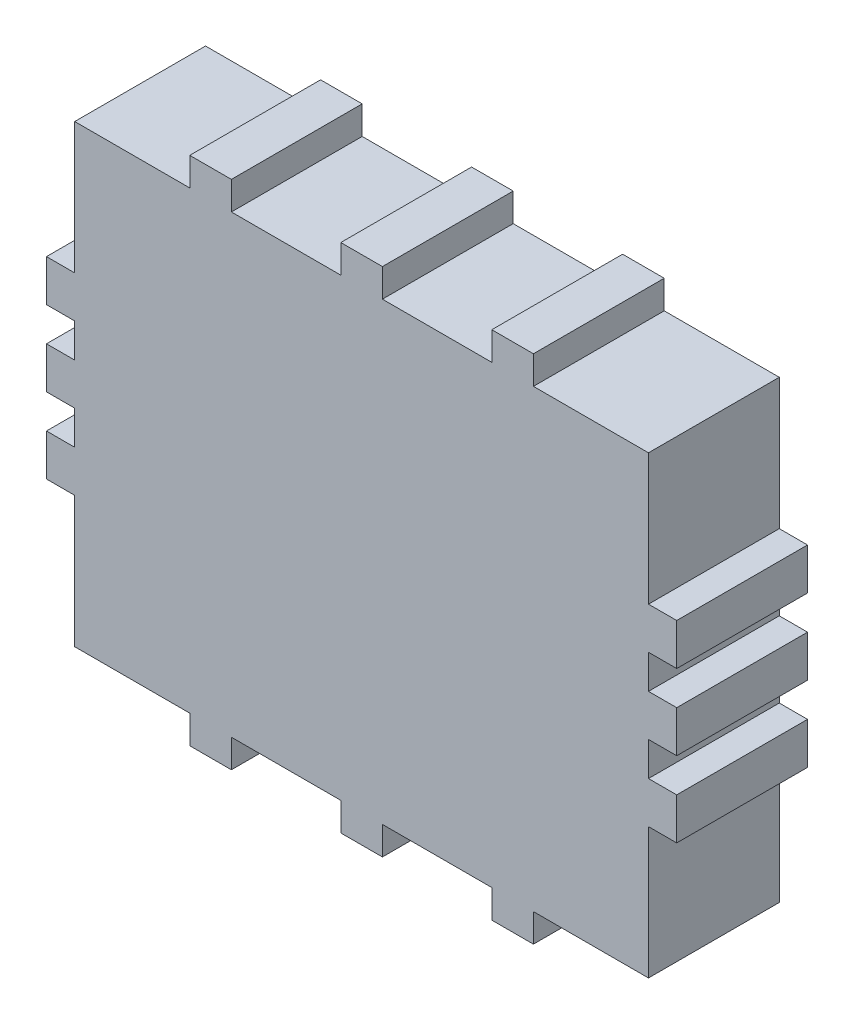
from build123d import *

# Parameters (mm, degrees)
COMPONENT_OUTLINE_DEPTH = 2.2


with BuildPart() as part:
    # 草图1 → Component_Outline (new body)
    with BuildSketch(Plane.XY):
        Polygon((-2.89, -4.3), (-2.89, -3.825), (-4.825, -3.825), (-4.825, -1.62), (-5.3, -1.62), (-5.3, -0.92), (-4.825, -0.92), (-4.825, -0.35), (-5.3, -0.35), (-5.3, 0.35), (-4.825, 0.35), (-4.825, 0.92), (-5.3, 0.92), (-5.3, 1.62), (-4.825, 1.62), (-4.825, 3.825), (-2.89, 3.825), (-2.89, 4.3), (-2.19, 4.3), (-2.19, 3.825), (-0.35, 3.825), (-0.35, 4.3), (0.35, 4.3), (0.35, 3.825), (2.19, 3.825), (2.19, 4.3), (2.89, 4.3), (2.89, 3.825), (4.825, 3.825), (4.825, 1.62), (5.3, 1.62), (5.3, 0.92), (4.825, 0.92), (4.825, 0.35), (5.3, 0.35), (5.3, -0.35), (4.825, -0.35), (4.825, -0.92), (5.3, -0.92), (5.3, -1.62), (4.825, -1.62), (4.825, -3.825), (2.89, -3.825), (2.89, -4.3), (2.19, -4.3), (2.19, -3.825), (0.35, -3.825), (0.35, -4.3), (-0.35, -4.3), (-0.35, -3.825), (-2.19, -3.825), (-2.19, -4.3), align=None)
    extrude(amount=COMPONENT_OUTLINE_DEPTH)


solid = part.part
